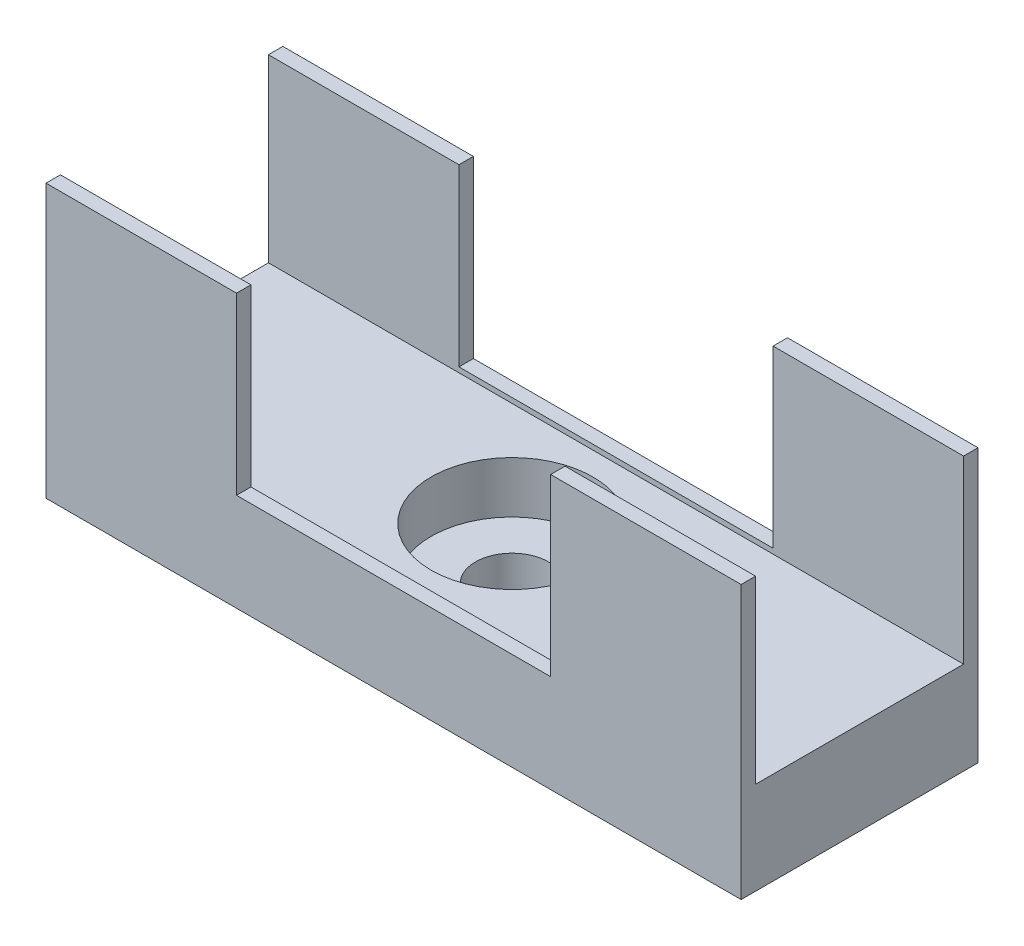
from build123d import *

# Parameters (mm, degrees)
SKETCH1_W           = 34.29
SKETCH1_H           = 11.684
BOSS_EXTRUDE1_DEPTH = 13.462
SKETCH3_W           = 15.494
SKETCH3_H           = 8.636
CUT_EXTRUDE1_DEPTH  = 23.622
SKETCH4_W           = 34.29
SKETCH4_H           = 10.2616
CUT_EXTRUDE2_DEPTH  = 8.89
SKETCH5_R           = 3.9878
CUT_EXTRUDE3_DEPTH  = 2.54
SKETCH6_R           = 1.8034
CUT_EXTRUDE4_DEPTH  = 7.62


with BuildPart() as part:
    # Sketch1 → Boss-Extrude1 (new body)
    with BuildSketch(Plane(origin=(0, 0, 0), x_dir=(1, 0, 0), z_dir=(0, 1, 0))):
        Rectangle(SKETCH1_W, SKETCH1_H)
    extrude(amount=BOSS_EXTRUDE1_DEPTH)

    # Sketch3 → Cut-Extrude1 (cut)
    with BuildSketch(Plane.XY.offset(5.842)):
        with Locations((0, 9.144)):
            Rectangle(SKETCH3_W, SKETCH3_H)
    extrude(amount=-CUT_EXTRUDE1_DEPTH, mode=Mode.SUBTRACT)

    # Sketch4 → Cut-Extrude2 (cut)
    with BuildSketch(Plane(origin=(0, 13.462, 0), x_dir=(1, 0, 0), z_dir=(0, 1, 0))):
        Rectangle(SKETCH4_W, SKETCH4_H)
    extrude(amount=-CUT_EXTRUDE2_DEPTH, mode=Mode.SUBTRACT)

    # Sketch5 → Cut-Extrude3 (cut)
    with BuildSketch(Plane(origin=(0, 4.572, 0), x_dir=(1, 0, 0), z_dir=(0, 1, 0))):
        with Locations(Location((0, 0, 0), (0, 0, 270))):
            Circle(SKETCH5_R)
    extrude(amount=-CUT_EXTRUDE3_DEPTH, mode=Mode.SUBTRACT)

    # Sketch6 → Cut-Extrude4 (cut)
    with BuildSketch(Plane(origin=(0, 2.032, 0), x_dir=(1, 0, 0), z_dir=(0, 1, 0))):
        with Locations(Location((0, 0, 0), (0, 0, 270))):
            Circle(SKETCH6_R)
    extrude(amount=-CUT_EXTRUDE4_DEPTH, mode=Mode.SUBTRACT)


solid = part.part
